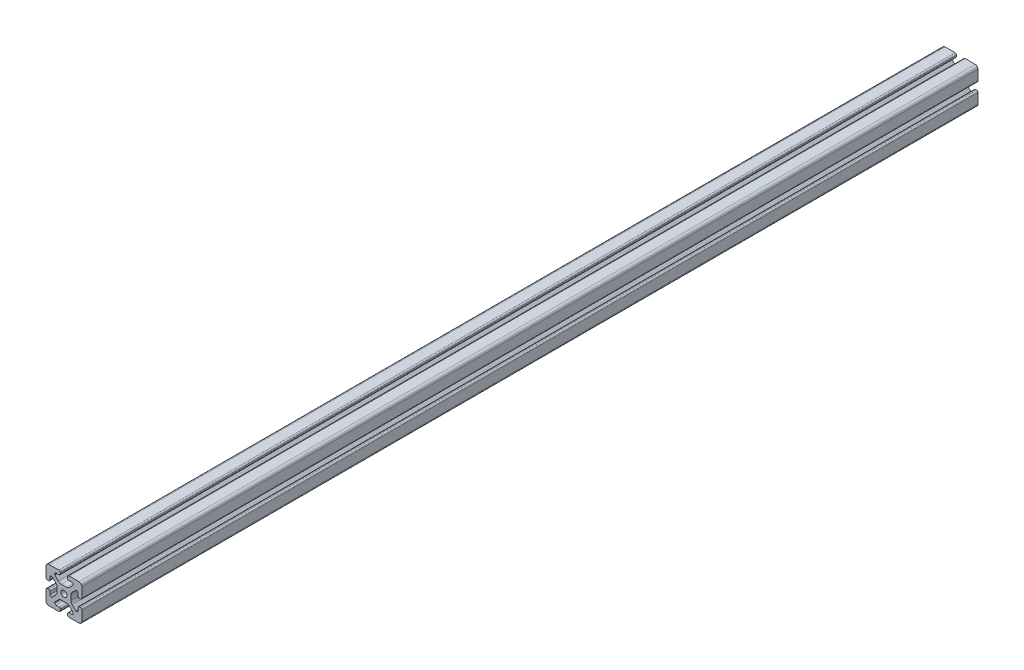
from build123d import *

# Parameters (mm, degrees)
SKETCH1_R      = 3.4
EXTRUDE1_DEPTH = 1000


with BuildPart() as part:
    # Sketch1 → Extrude1 (new body)
    with BuildSketch(Plane.XY):
        with BuildLine():
            Line((-8.715, -15.524615034), (-5.63, -15.524615034))
            ThreePointArc((-5.63, -15.524615034), (-4.519842354, -15.984457388), (-4.06, -17.094615034))
            Line((-4.06, -17.094615034), (-4.06, -18.43))
            ThreePointArc((-4.06, -18.43), (-4.519842354, -19.540157646), (-5.63, -20))
            Line((-5.63, -20), (-16.674615034, -20))
            ThreePointArc((-16.674615034, -20), (-18.951578385, -19.194274381), (-20, -17.018368134))
            Line((-20, -17.018368134), (-20, -5.757918808))
            ThreePointArc((-20, -5.757918808), (-19.564709668, -4.603883664), (-18.43, -4.120449326))
            Line((-18.43, -4.120449326), (-17.25, -4.120449326))
            ThreePointArc((-17.25, -4.120449326), (-16.115287682, -4.60388249), (-15.67999625, -5.757919334))
            Line((-15.67999625, -5.757919334), (-15.67999625, -8.715399492))
            ThreePointArc((-15.67999625, -8.715399492), (-15.220153896, -9.825557139), (-14.10999625, -10.285399492))
            Line((-14.10999625, -10.285399492), (-13.816898819, -10.285399492))
            ThreePointArc((-13.816898819, -10.285399492), (-13.526061711, -10.227547119), (-13.279501941, -10.062800646))
            Line((-13.279501941, -10.062800646), (-9.076242789, -5.859541495))
            ThreePointArc((-9.076242789, -5.859541495), (-8.046572221, -4.318530588), (-7.685, -2.500784284))
            Line((-7.685, -2.500784284), (-7.685, 2.500784284))
            ThreePointArc((-7.685, 2.500784284), (-8.046572221, 4.318530588), (-9.076242789, 5.859541495))
            Line((-9.076242789, 5.859541495), (-13.040489136, 9.823787841))
            ThreePointArc((-13.040489136, 9.823787841), (-13.354224618, 10.012729352), (-13.71989919, 10.033001362))
            Line((-13.71989919, 10.033001362), (-14.05520779, 10.044710596))
            ThreePointArc((-14.05520779, 10.044710596), (-15.200613642, 9.605030484), (-15.68, 8.475666998))
            Line((-15.68, 8.475666998), (-15.68, 5.572979049))
            ThreePointArc((-15.68, 5.572979049), (-16.139842354, 4.462821403), (-17.25, 4.002979049))
            Line((-17.25, 4.002979049), (-18.43, 4.002979049))
            ThreePointArc((-18.43, 4.002979049), (-19.540157646, 4.462821403), (-20, 5.572979049))
            Line((-20, 5.572979049), (-20, 13.004526564))
            Line((-20, 13.004526564), (-20, 16.83))
            ThreePointArc((-20, 16.83), (-19.071528496, 19.071528496), (-16.83, 20))
            Line((-16.83, 20), (-5.63, 20))
            ThreePointArc((-5.63, 20), (-4.519842354, 19.540157646), (-4.06, 18.43))
            Line((-4.06, 18.43), (-4.06, 17.094615034))
            ThreePointArc((-4.06, 17.094615034), (-4.519842354, 15.984457388), (-5.63, 15.524615034))
            Line((-5.63, 15.524615034), (-8.715, 15.524615034))
            ThreePointArc((-8.715, 15.524615034), (-9.825157646, 15.06477268), (-10.285, 13.954615034))
            Line((-10.285, 13.954615034), (-10.285, 13.492503602))
            ThreePointArc((-10.285, 13.492503602), (-10.227148445, 13.201664194), (-10.062401154, 12.955102448))
            Line((-10.062401154, 12.955102448), (-6.217092793, 9.109794088))
            ThreePointArc((-6.217092793, 9.109794088), (-4.63891877, 8.055291919), (-2.777335583, 7.685))
            Line((-2.777335583, 7.685), (2.777335583, 7.685))
            ThreePointArc((2.777335583, 7.685), (4.63891877, 8.055291919), (6.217092793, 9.109794088))
            Line((6.217092793, 9.109794088), (10.062401154, 12.955102448))
            ThreePointArc((10.062401154, 12.955102448), (10.227148445, 13.201664194), (10.285, 13.492503602))
            Line((10.285, 13.492503602), (10.285, 13.954615034))
            ThreePointArc((10.285, 13.954615034), (9.825157646, 15.06477268), (8.715, 15.524615034))
            Line((8.715, 15.524615034), (5.63, 15.524615034))
            ThreePointArc((5.63, 15.524615034), (4.519842354, 15.984457388), (4.06, 17.094615034))
            Line((4.06, 17.094615034), (4.06, 18.43))
            ThreePointArc((4.06, 18.43), (4.519842354, 19.540157646), (5.63, 20))
            Line((5.63, 20), (12.979635074, 20))
            Line((12.979635074, 20), (16.83, 20))
            ThreePointArc((16.83, 20), (19.071528496, 19.071528496), (20, 16.83))
            Line((20, 16.83), (20, 13.001098436))
            Line((20, 13.001098436), (20, 5.63))
            ThreePointArc((20, 5.63), (19.540157461, 4.519842693), (18.43, 4.060000526))
            Line((18.43, 4.060000526), (17.24999625, 4.060000526))
            ThreePointArc((17.24999625, 4.060000526), (16.139838603, 4.519842879), (15.67999625, 5.630000526))
            Line((15.67999625, 5.630000526), (15.67999625, 8.715399492))
            ThreePointArc((15.67999625, 8.715399492), (15.220153896, 9.825557139), (14.10999625, 10.285399492))
            Line((14.10999625, 10.285399492), (13.816903094, 10.285399492))
            ThreePointArc((13.816903094, 10.285399492), (13.526063686, 10.227547937), (13.279501941, 10.062800646))
            Line((13.279501941, 10.062800646), (9.076242789, 5.859541495))
            ThreePointArc((9.076242789, 5.859541495), (8.046572221, 4.318530588), (7.685, 2.500784284))
            Line((7.685, 2.500784284), (7.685, -2.500784284))
            ThreePointArc((7.685, -2.500784284), (8.046572221, -4.318530588), (9.076242789, -5.859541495))
            Line((9.076242789, -5.859541495), (13.163657296, -9.946956002))
            ThreePointArc((13.163657296, -9.946956002), (13.35903797, -10.160433474), (13.6200547, -10.285399492))
            Line((13.6200547, -10.285399492), (14.10999625, -10.285399492))
            ThreePointArc((14.10999625, -10.285399492), (15.220153896, -9.825557139), (15.67999625, -8.715399492))
            Line((15.67999625, -8.715399492), (15.67999625, -5.630000526))
            ThreePointArc((15.67999625, -5.630000526), (16.139838603, -4.519842879), (17.24999625, -4.060000526))
            Line((17.24999625, -4.060000526), (18.43, -4.060000526))
            ThreePointArc((18.43, -4.060000526), (19.540157461, -4.519842693), (20, -5.63))
            Line((20, -5.63), (20, -16.83))
            ThreePointArc((20, -16.83), (19.071528496, -19.071528496), (16.83, -20))
            Line((16.83, -20), (13, -20))
            Line((13, -20), (5.63, -20))
            ThreePointArc((5.63, -20), (4.519842354, -19.540157646), (4.06, -18.43))
            Line((4.06, -18.43), (4.06, -17.094615034))
            ThreePointArc((4.06, -17.094615034), (4.519842354, -15.984457388), (5.63, -15.524615034))
            Line((5.63, -15.524615034), (8.715, -15.524615034))
            ThreePointArc((8.715, -15.524615034), (9.825157646, -15.06477268), (10.285, -13.954615034))
            Line((10.285, -13.954615034), (10.285, -13.492503602))
            ThreePointArc((10.285, -13.492503602), (10.227148445, -13.201664194), (10.062401154, -12.955102448))
            Line((10.062401154, -12.955102448), (6.217092793, -9.109794088))
            ThreePointArc((6.217092793, -9.109794088), (4.63891877, -8.055291919), (2.777335583, -7.685))
            Line((2.777335583, -7.685), (-2.777335583, -7.685))
            ThreePointArc((-2.777335583, -7.685), (-4.63891877, -8.055291919), (-6.217092793, -9.109794088))
            Line((-6.217092793, -9.109794088), (-10.062401154, -12.955102448))
            ThreePointArc((-10.062401154, -12.955102448), (-10.227148445, -13.201664194), (-10.285, -13.492503602))
            Line((-10.285, -13.492503602), (-10.285, -13.954615034))
            ThreePointArc((-10.285, -13.954615034), (-9.825157646, -15.06477268), (-8.715, -15.524615034))
        make_face()
        Circle(SKETCH1_R, mode=Mode.SUBTRACT)
    extrude(amount=-EXTRUDE1_DEPTH)


solid = part.part
